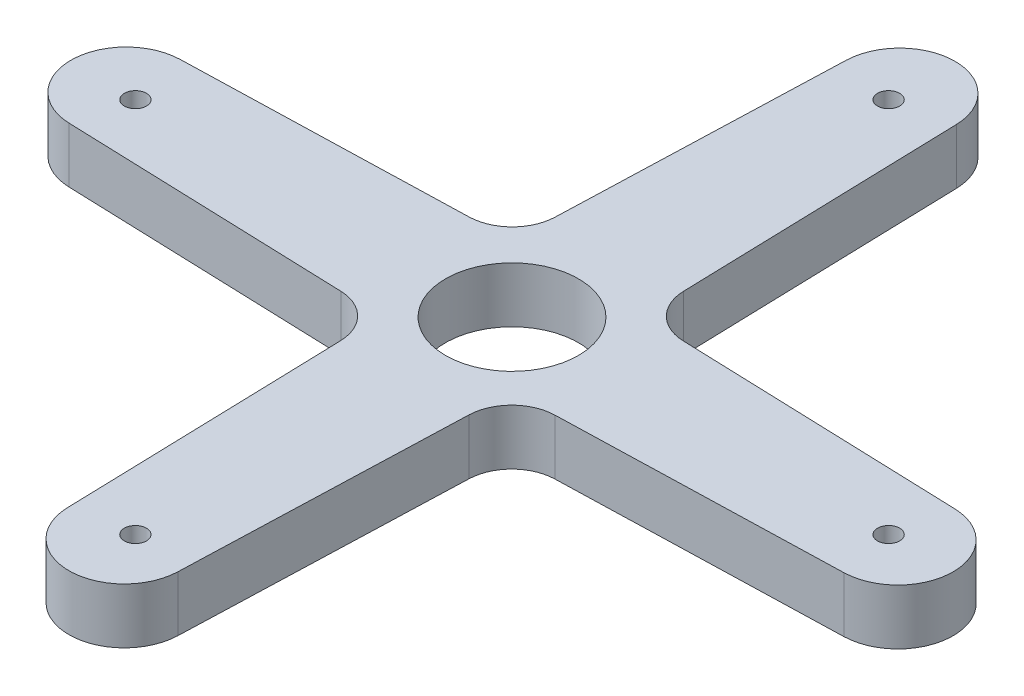
from build123d import *

# Parameters (mm, degrees)
BOSS_EXTRUDE1_DEPTH = 2.5
FILLET1_R           = 2
SKETCH3_R           = 0.5
SKETCH3_R_2         = 3
CUT_EXTRUDE1_DEPTH  = 2.5


with BuildPart() as part:
    # Sketch1 → Boss-Extrude1 (new body)
    with BuildSketch(Plane(origin=(0, 0, 0), x_dir=(1, 0, 0), z_dir=(0, 1, 0))):
        with BuildLine():
            Line((2.915475138, 3), (2.498974366, 17.571434122))
            ThreePointArc((2.498974366, 17.571434122), (0, 20), (-2.498974366, 17.571434122))
            Line((-2.498974366, 17.571434122), (-3, 3))
            Line((-3, 3), (-17.571434122, 2.583499228))
            ThreePointArc((-17.571434122, 2.583499228), (-20, 0.084524862), (-17.571434122, -2.414449503))
            Line((-17.571434122, -2.414449503), (-3, -2.915475138))
            Line((-3, -2.915475138), (-2.583499228, -17.48690926))
            ThreePointArc((-2.583499228, -17.48690926), (-0.084524862, -19.915475138), (2.414449503, -17.48690926))
            Line((2.414449503, -17.48690926), (2.915475138, -2.915475138))
            Line((2.915475138, -2.915475138), (17.48690926, -2.498974366))
            ThreePointArc((17.48690926, -2.498974366), (19.915475138, 0), (17.48690926, 2.498974366))
            Line((17.48690926, 2.498974366), (2.915475138, 3))
        make_face()
    extrude(amount=BOSS_EXTRUDE1_DEPTH)

    # Fillet1
    fillet1_edges = [part.edges().sort_by_distance(p)[0] for p in [
        (-3, 1.25, 2.915475138),
        (-3, 1.25, -3),
        (2.915475138, 1.25, -3),
        (2.915475138, 1.25, 2.915475138),
    ]]
    fillet(fillet1_edges, radius=FILLET1_R)

    # Sketch3 → Cut-Extrude1 (cut)
    with BuildSketch(Plane(origin=(0, 2.5, 0), x_dir=(1, 0, 0), z_dir=(0, 1, 0))):
        with Locations(Location((0, 17, 0), (0, 0, 270))):
            Circle(SKETCH3_R)
        with Locations(Location((17, 0, 0), (0, 0, 270))):
            Circle(SKETCH3_R)
        with Locations(Location((0, -17, 0), (0, 0, 270))):
            Circle(SKETCH3_R)
        with Locations(Location((-17, 0, 0), (0, 0, 270))):
            Circle(SKETCH3_R)
        with Locations(Location((0, 0, 0), (0, 0, 270))):
            Circle(SKETCH3_R_2)
    extrude(amount=-CUT_EXTRUDE1_DEPTH, mode=Mode.SUBTRACT)


solid = part.part
